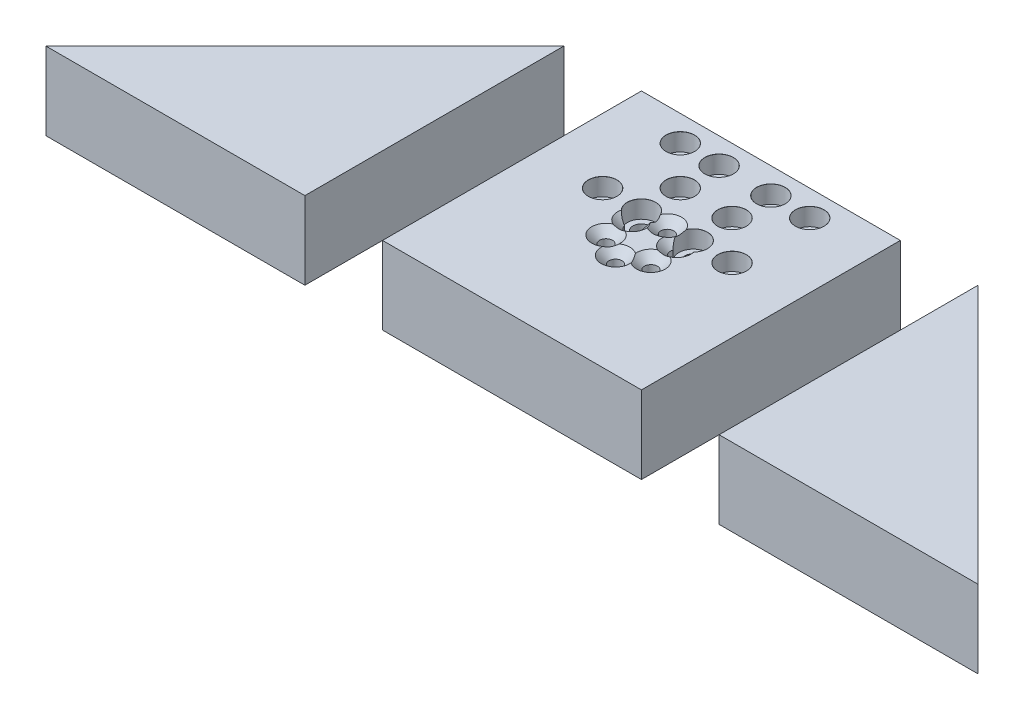
from build123d import *

# Parameters (mm, degrees)
EXTRUDE_1_DEPTH             = 30
SKETCH_1_W                  = 100
SKETCH_1_H                  = 100
EXTRUDE_1_2_DEPTH           = 30
PATTERN_LINEAR_1_COUNT      = 2
PATTERN_LINEAR_1_PITCH      = 15
PATTERN_LINEAR_1_COUNT_DIR2 = 3
PATTERN_LINEAR_1_PITCH_DIR2 = 15
PATTERN_CIRCULAR_1_COUNT    = 6


with BuildPart() as part:
    # 草图1 → 凸台-拉伸1 (new body)
    with BuildSketch(Plane(origin=(0, 0, 0), x_dir=(1, 0, 0), z_dir=(0, 1, 0))):
        Polygon((80, -50), (180, -50), (80, 50), align=None)
    extrude(amount=EXTRUDE_1_DEPTH)


with BuildPart() as body_2:
    # 草图1 → Extrude 1 2 (new body)
    with BuildSketch(Plane(origin=(0, 0, 0), x_dir=(1, 0, 0), z_dir=(0, 1, 0))):
        Rectangle(SKETCH_1_W, SKETCH_1_H)
    extrude(amount=EXTRUDE_1_2_DEPTH)

    # 草图6 → Hole Wizard M6 _2 (revolve, cut)
    with BuildSketch(Plane(origin=(-25, 30, -10), x_dir=(0, 0, 1), z_dir=(1, 0, 0))):
        Polygon((0, 0), (0, 30), (3.3, 30), (3.3, 6.8), (5.5, 6.8), (5.5, 0.025), (5.525, 0), align=None)
    hole_wizard_m6_2 = revolve(axis=Axis((-25, 36.35, -10), (0, -1, 0)), mode=Mode.SUBTRACT)

    # 草图14 → Hole Wizard M6 _2 2 (revolve, cut)
    with BuildSketch(Plane(origin=(0, 30, -10), x_dir=(0, 0, 1), z_dir=(1, 0, 0))):
        Polygon((0, 0), (0, 30), (2.5, 30), (2.5, 3.025), (5.525, 0), align=None)
    hole_wizard_m6_2_2 = revolve(axis=Axis((0, 36.35, -10), (0, -1, 0)), mode=Mode.SUBTRACT)

    # 阵列(线性)1: Hole Wizard M6 _2 2 × 3, 1 skipped
    with Locations(*[(i * PATTERN_LINEAR_1_PITCH, 0, -j * PATTERN_LINEAR_1_PITCH_DIR2) for i in range(PATTERN_LINEAR_1_COUNT) for j in range(PATTERN_LINEAR_1_COUNT_DIR2) if (i, j) not in ((0, 0), (0, 1))]):
        add(hole_wizard_m6_2, mode=Mode.SUBTRACT)

    # 阵列(圆周)1: Hole Wizard M6 _2 2 ×6 about axis
    pattern_circular_1_axis = Axis((0, 0, 0), (0, 1, 0))
    for i in range(1, PATTERN_CIRCULAR_1_COUNT):
        add(hole_wizard_m6_2_2.rotate(pattern_circular_1_axis, i * 360 / PATTERN_CIRCULAR_1_COUNT), mode=Mode.SUBTRACT)

    # 镜向1 copy 1 sketch → 镜向1 copy 1 (revolve, cut)
    with BuildSketch(Plane(origin=(25, 30, -40), x_dir=(0, 0, 1), z_dir=(-1, 0, 0))):
        Polygon((0, 0), (0, -30), (3.3, -30), (3.3, -6.8), (5.5, -6.8), (5.5, -0.025), (5.525, 0), align=None)
    revolve(axis=Axis((25, 36.35, -40), (0, 1, 0)), mode=Mode.SUBTRACT)

    # 镜向1 copy 2 sketch → 镜向1 copy 2 (revolve, cut)
    with BuildSketch(Plane(origin=(10, 30, -10), x_dir=(0, 0, 1), z_dir=(-1, 0, 0))):
        Polygon((0, 0), (0, -30), (3.3, -30), (3.3, -6.8), (5.5, -6.8), (5.5, -0.025), (5.525, 0), align=None)
    revolve(axis=Axis((10, 36.35, -10), (0, 1, 0)), mode=Mode.SUBTRACT)

    # 镜向1 copy 3 sketch → 镜向1 copy 3 (revolve, cut)
    with BuildSketch(Plane(origin=(10, 30, -25), x_dir=(0, 0, 1), z_dir=(-1, 0, 0))):
        Polygon((0, 0), (0, -30), (3.3, -30), (3.3, -6.8), (5.5, -6.8), (5.5, -0.025), (5.525, 0), align=None)
    revolve(axis=Axis((10, 36.35, -25), (0, 1, 0)), mode=Mode.SUBTRACT)

    # 镜向1 copy 4 sketch → 镜向1 copy 4 (revolve, cut)
    with BuildSketch(Plane(origin=(10, 30, -40), x_dir=(0, 0, 1), z_dir=(-1, 0, 0))):
        Polygon((0, 0), (0, -30), (3.3, -30), (3.3, -6.8), (5.5, -6.8), (5.5, -0.025), (5.525, 0), align=None)
    revolve(axis=Axis((10, 36.35, -40), (0, 1, 0)), mode=Mode.SUBTRACT)

    # 镜向1 copy 5 sketch → 镜向1 copy 5 (revolve, cut)
    with BuildSketch(Plane(origin=(25, 30, -10), x_dir=(0, 0, 1), z_dir=(-1, 0, 0))):
        Polygon((0, 0), (0, -30), (3.3, -30), (3.3, -6.8), (5.5, -6.8), (5.5, -0.025), (5.525, 0), align=None)
    revolve(axis=Axis((25, 36.35, -10), (0, 1, 0)), mode=Mode.SUBTRACT)


with BuildPart() as body_3:
    # 镜向3: mirrored copy
    add(part.part.mirror(Plane(origin=(0, 0, 0), x_dir=(0, 0, 1), z_dir=(1, 0, 0))))


solid = Compound([part.part, body_2.part, body_3.part])
